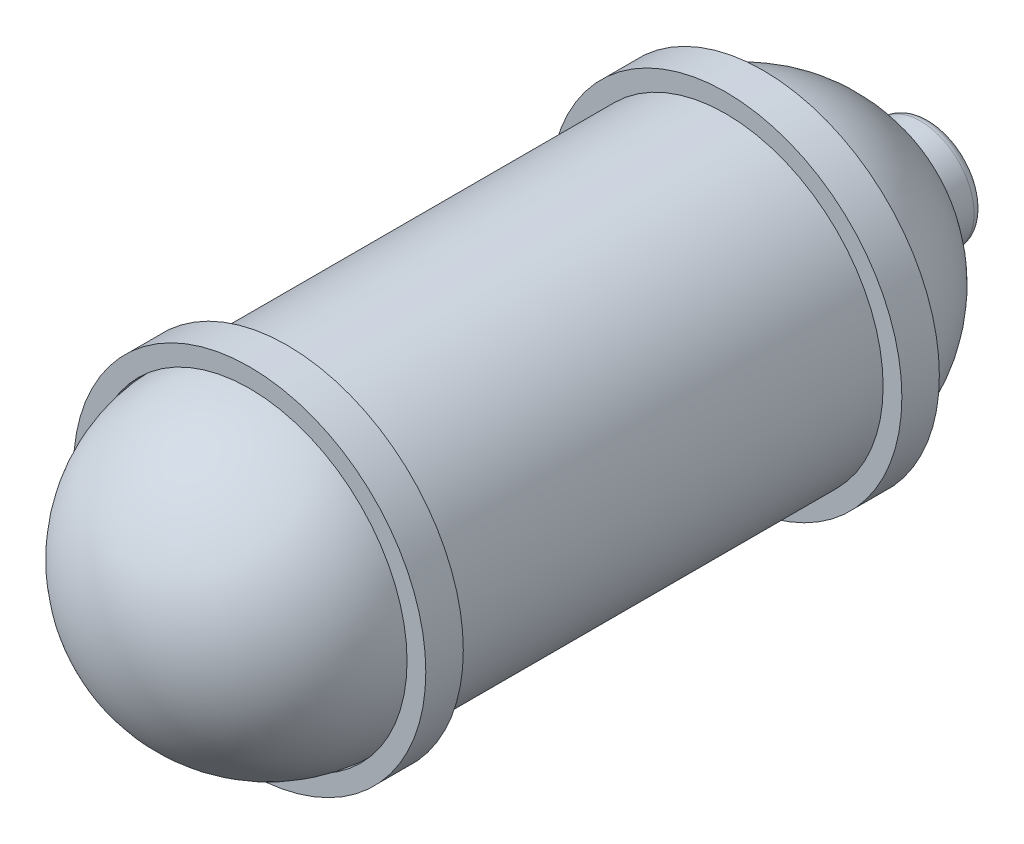
from build123d import *

# Parameters (mm, degrees)
SKETCH1_R           = 840
SKETCH1_R_2         = 710
BOSS_EXTRUDE1_DEPTH = 1270
SKETCH5_R           = 940
SKETCH5_R_2         = 840
BOSS_EXTRUDE2_DEPTH = 100
SKETCH7_R           = 400
CUT_EXTRUDE1_DEPTH  = 50
SKETCH10_R          = 285.482048
CUT_EXTRUDE2_DEPTH  = 340
SKETCH11_R          = 285.482048
BOSS_EXTRUDE4_DEPTH = 200
FILLET2_R           = 50


with BuildPart() as part:
    # Sketch1 → Boss-Extrude1 (new, symmetric)
    with BuildSketch(Plane.XY):
        with Locations(Location((0, 0, 0), (0, 0, 180))):
            Circle(SKETCH1_R)
        with Locations(Location((0, 0, 0), (0, 0, 180))):
            Circle(SKETCH1_R_2, mode=Mode.SUBTRACT)
    extrude(amount=BOSS_EXTRUDE1_DEPTH, both=True)

    # Sketch4 → Revolve1 (revolve)
    with BuildSketch(Plane(origin=(0, 0, 0), x_dir=(0, 0, -1), z_dir=(1, 0, 0))):
        with BuildLine():
            Line((1270, 840), (1270, 710))
            ThreePointArc((1270, 710), (1772.045815, 502.045815), (1980, 0))
            Line((1980, 0), (2110, 0))
            ThreePointArc((2110, 0), (1863.969696, 593.969696), (1270, 840))
        make_face()
    revolve1 = revolve(axis=Axis((0, 0, -1270), (0, 0, -1)))

    # Mirror1: Revolve1 across plane
    add(revolve1.mirror(Plane.XY))

    # Sketch5 → Boss-Extrude2 (add, symmetric)
    with BuildSketch(Plane.XY.offset(-1270)):
        Circle(SKETCH5_R)
        with Locations(Location((0, 0, 0), (0, 0, 180))):
            Circle(SKETCH5_R_2, mode=Mode.SUBTRACT)
    boss_extrude2 = extrude(amount=BOSS_EXTRUDE2_DEPTH, both=True)

    # Mirror2: Boss-Extrude2 across plane
    add(boss_extrude2.mirror(Plane.XY))

    # Sketch7 → Cut-Extrude1 (cut, symmetric)
    with BuildSketch(Plane(origin=(0, 0, -2110), x_dir=(-1, 0, 0), z_dir=(0, 0, -1))):
        Circle(SKETCH7_R)
    extrude(amount=CUT_EXTRUDE1_DEPTH, both=True, mode=Mode.SUBTRACT)

    # Sketch10 → Cut-Extrude2 (cut)
    with BuildSketch(Plane(origin=(0, 0, -2060), x_dir=(-1, 0, 0), z_dir=(0, 0, -1))):
        Circle(SKETCH10_R)
    extrude(amount=-CUT_EXTRUDE2_DEPTH, mode=Mode.SUBTRACT)


with BuildPart() as body_2:
    # Sketch11 → Boss-Extrude4 (new body)
    with BuildSketch(Plane.XY.offset(-2060)):
        Circle(SKETCH11_R)
    extrude(amount=-BOSS_EXTRUDE4_DEPTH)

    # Fillet2
    fillet2_edges = [body_2.edges().sort_by_distance(p)[0] for p in [
        (-285.482048, 0, -2260),
    ]]
    fillet(fillet2_edges, radius=FILLET2_R)


solid = Compound([part.part, body_2.part])
